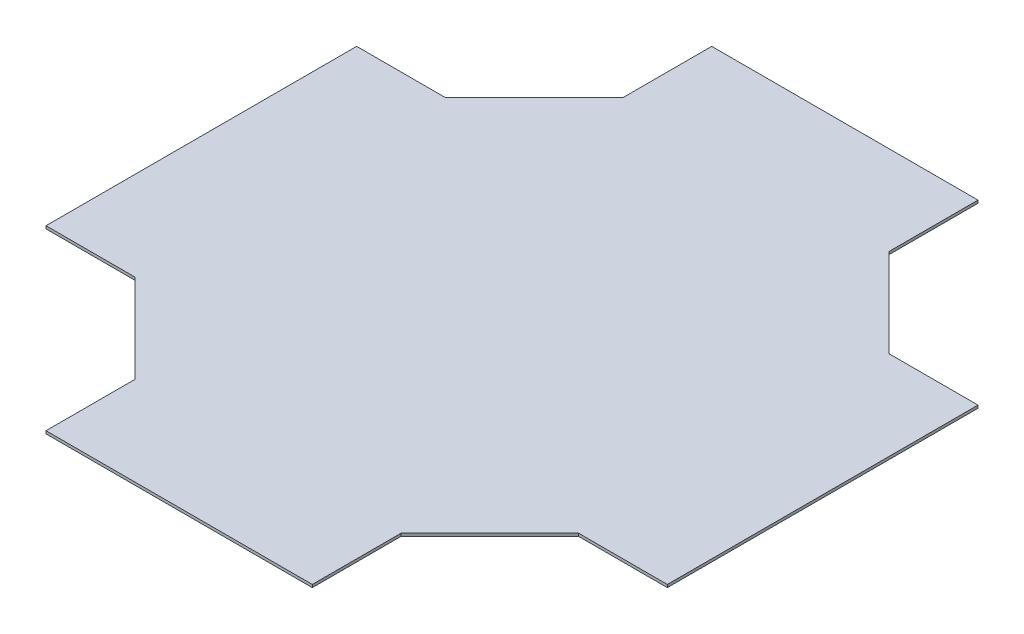
from build123d import *

# Parameters (mm, degrees)
SKETCH1_W           = 304.8
SKETCH1_H           = 355.6
BOSS_EXTRUDE1_DEPTH = 1.5875


with BuildPart() as part:
    # Sketch1 → Boss-Extrude1 (new, symmetric)
    with BuildSketch(Plane(origin=(0, 0, 0), x_dir=(1, 0, 0), z_dir=(0, 1, 0))):
        Polygon((-152.4, -177.8), (-152.4, 177.8), (-254, 177.8), (-355.6, 177.8), (-355.6, -177.8), (-254, -177.8), align=None)
        Rectangle(SKETCH1_W, SKETCH1_H)
        Polygon((152.4, 177.8), (152.4, 279.4), (152.4, 381), (-152.4, 381), (-152.4, 279.4), (-152.4, 177.8), align=None)
        Polygon((152.4, -279.4), (152.4, -177.8), (-152.4, -177.8), (-152.4, -279.4), (-152.4, -381), (152.4, -381), align=None)
        Polygon((355.6, 177.8), (254, 177.8), (152.4, 177.8), (152.4, -177.8), (254, -177.8), (355.6, -177.8), align=None)
        Polygon((152.4, 177.8), (254, 177.8), (152.4, 279.4), align=None)
        Polygon((254, -177.8), (152.4, -177.8), (152.4, -279.4), align=None)
        Polygon((-152.4, -279.4), (-152.4, -177.8), (-254, -177.8), align=None)
        Polygon((-254, 177.8), (-152.4, 177.8), (-152.4, 279.4), align=None)
    extrude(amount=BOSS_EXTRUDE1_DEPTH, both=True)


solid = part.part
